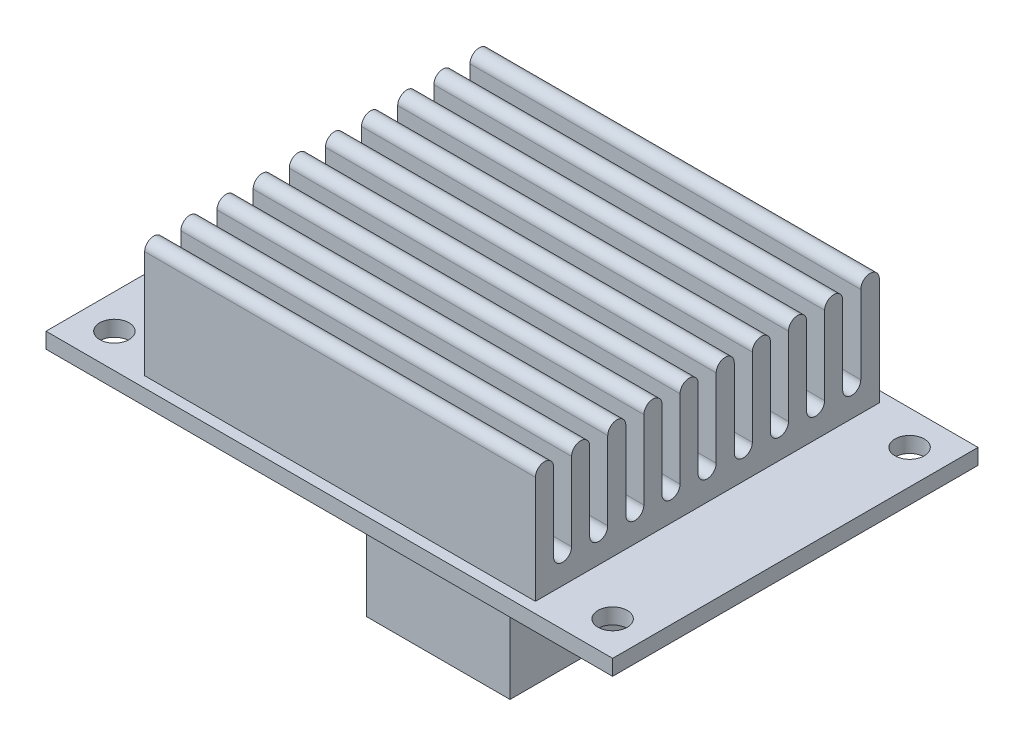
from build123d import *

# Parameters (mm, degrees)
SKETCH1_W                = 58
SKETCH1_H                = 37.4
SKETCH1_R                = 1.5
BOSS_EXTRUDE1_DEPTH      = 1.6
BOSS_EXTRUDE2_DEPTH      = 20
BOSS_EXTRUDE2_DEPTH_BACK = 20
SKETCH3_W                = 14.7
SKETCH3_H                = 14.3
BOSS_EXTRUDE3_DEPTH      = 7.8
SKETCH4_R                = 4
BOSS_EXTRUDE4_DEPTH      = 10.7
BOSS_EXTRUDE4_2_DEPTH    = 10.7
SKETCH5_W                = 9.5
SKETCH5_H                = 9.4
BOSS_EXTRUDE5_DEPTH      = 10


with BuildPart() as part:
    # Sketch1 → Boss-Extrude1 (new body)
    with BuildSketch(Plane(origin=(0, 0, 0), x_dir=(1, 0, 0), z_dir=(0, 1, 0))):
        Rectangle(SKETCH1_W, SKETCH1_H)
        with Locations(Location((25.5, 15.2, 0), (0, 0, 270))):
            Circle(SKETCH1_R, mode=Mode.SUBTRACT)
        with Locations(Location((25.5, -15.2, 0), (0, 0, 270))):
            Circle(SKETCH1_R, mode=Mode.SUBTRACT)
        with Locations(Location((-25.5, -15.2, 0), (0, 0, 270))):
            Circle(SKETCH1_R, mode=Mode.SUBTRACT)
        with Locations(Location((-25.5, 15.2, 0), (0, 0, 270))):
            Circle(SKETCH1_R, mode=Mode.SUBTRACT)
    extrude(amount=BOSS_EXTRUDE1_DEPTH)


with BuildPart() as body_2:
    # Sketch2 → Boss-Extrude2 (new, two sides: drawn at the far end of the back side and taken through both)
    with BuildSketch(Plane(origin=(0, 0, 0), x_dir=(0, 0, -1), z_dir=(1, 0, 0)).offset(-BOSS_EXTRUDE2_DEPTH_BACK)):
        with BuildLine():
            Line((-17.6, 12.6), (-17.6, 1.6))
            Line((-17.6, 1.6), (17.6, 1.6))
            Line((17.6, 1.6), (17.6, 12.6))
            ThreePointArc((17.6, 12.6), (16.65, 13.55), (15.7, 12.6))
            Line((15.7, 12.6), (15.7, 4.6))
            ThreePointArc((15.7, 4.6), (14.775, 3.675), (13.85, 4.6))
            Line((13.85, 4.6), (13.85, 12.6))
            ThreePointArc((13.85, 12.6), (12.925, 13.525), (12, 12.6))
            Line((12, 12.6), (12, 4.6))
            ThreePointArc((12, 4.6), (11.075, 3.675), (10.15, 4.6))
            Line((10.15, 4.6), (10.15, 12.6))
            ThreePointArc((10.15, 12.6), (9.225, 13.525), (8.3, 12.6))
            Line((8.3, 12.6), (8.3, 4.6))
            ThreePointArc((8.3, 4.6), (7.375, 3.675), (6.45, 4.6))
            Line((6.45, 4.6), (6.45, 12.6))
            ThreePointArc((6.45, 12.6), (5.525, 13.525), (4.6, 12.6))
            Line((4.6, 12.6), (4.6, 4.6))
            ThreePointArc((4.6, 4.6), (3.675, 3.675), (2.75, 4.6))
            Line((2.75, 4.6), (2.75, 12.6))
            ThreePointArc((2.75, 12.6), (1.825, 13.525), (0.9, 12.6))
            Line((0.9, 12.6), (0.9, 4.6))
            ThreePointArc((0.9, 4.6), (-0.025, 3.675), (-0.95, 4.6))
            Line((-0.95, 4.6), (-0.95, 12.6))
            ThreePointArc((-0.95, 12.6), (-1.875, 13.525), (-2.8, 12.6))
            Line((-2.8, 12.6), (-2.8, 4.6))
            ThreePointArc((-2.8, 4.6), (-3.725, 3.675), (-4.65, 4.6))
            Line((-4.65, 4.6), (-4.65, 12.6))
            ThreePointArc((-4.65, 12.6), (-5.575, 13.525), (-6.5, 12.6))
            Line((-6.5, 12.6), (-6.5, 4.6))
            ThreePointArc((-6.5, 4.6), (-7.425, 3.675), (-8.35, 4.6))
            Line((-8.35, 4.6), (-8.35, 12.6))
            ThreePointArc((-8.35, 12.6), (-9.275, 13.525), (-10.2, 12.6))
            Line((-10.2, 12.6), (-10.2, 4.6))
            ThreePointArc((-10.2, 4.6), (-11.125, 3.675), (-12.05, 4.6))
            Line((-12.05, 4.6), (-12.05, 12.6))
            Line((-12.05, 12.6), (-13.9, 12.6))
            Line((-13.9, 12.6), (-13.9, 4.6))
            ThreePointArc((-13.9, 4.6), (-14.825, 3.675), (-15.75, 4.6))
            Line((-15.75, 4.6), (-15.75, 12.6))
            ThreePointArc((-15.75, 12.6), (-16.675, 13.525), (-17.6, 12.6))
        make_face()
        with BuildLine():
            ThreePointArc((-12.05, 12.6), (-12.975, 13.525), (-13.9, 12.6))
            Line((-13.9, 12.6), (-12.05, 12.6))
        make_face()
    extrude(amount=BOSS_EXTRUDE2_DEPTH + BOSS_EXTRUDE2_DEPTH_BACK)


with BuildPart() as body_3:
    # Sketch3 → Boss-Extrude3 (new body)
    with BuildSketch(Plane(origin=(0, 0, 0), x_dir=(-1, 0, 0), z_dir=(0, -1, 0))):
        with Locations((-10.65, -11.05)):
            Rectangle(SKETCH3_W, SKETCH3_H)
    extrude(amount=BOSS_EXTRUDE3_DEPTH)


with BuildPart() as body_4:
    # Sketch4 → Boss-Extrude4 (new body)
    with BuildSketch(Plane(origin=(0, 0, 0), x_dir=(-1, 0, 0), z_dir=(0, -1, 0))):
        with Locations(Location((-7, 14.4, 0), (0, 0, 90))):
            Circle(SKETCH4_R)
    extrude(amount=BOSS_EXTRUDE4_DEPTH)


with BuildPart() as body_5:
    # Sketch4 → Boss-Extrude4 2 (new body)
    with BuildSketch(Plane(origin=(0, 0, 0), x_dir=(-1, 0, 0), z_dir=(0, -1, 0))):
        with Locations(Location((-7, 5.9, 0), (0, 0, 90))):
            Circle(SKETCH4_R)
    extrude(amount=BOSS_EXTRUDE4_2_DEPTH)


with BuildPart() as body_6:
    # Sketch5 → Boss-Extrude5 (new body)
    with BuildSketch(Plane(origin=(0, 0, 0), x_dir=(-1, 0, 0), z_dir=(0, -1, 0))):
        with Locations((24.05, 7.5)):
            Rectangle(SKETCH5_W, SKETCH5_H)
    extrude(amount=BOSS_EXTRUDE5_DEPTH)


solid = Compound([part.part, body_2.part, body_3.part, body_4.part, body_5.part, body_6.part])
